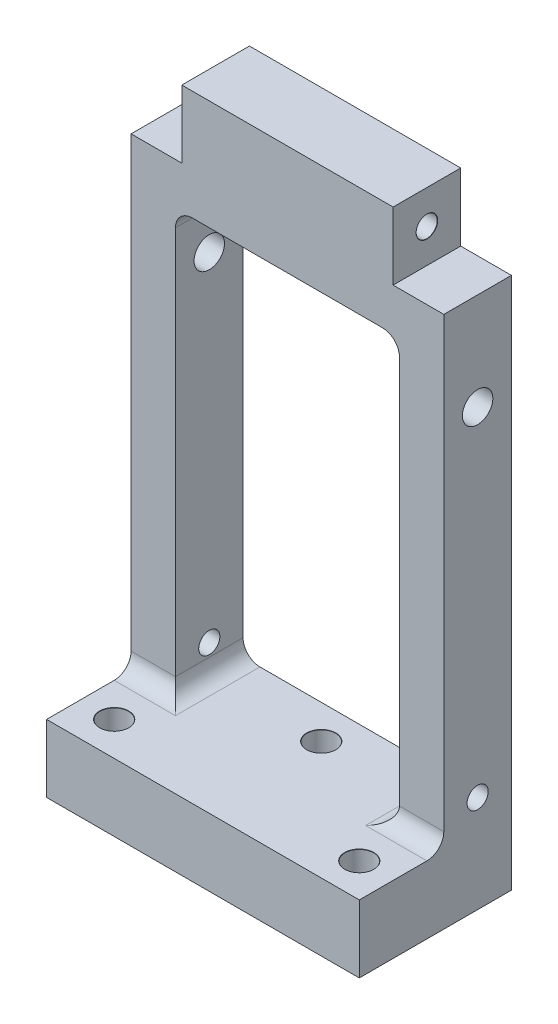
from build123d import *

# Parameters (mm, degrees)
SKETCH1_W                             = 37
SKETCH1_H                             = 63
BOSS_EXTRUDE1_DEPTH                   = 8
SKETCH2_R                             = 1
CUT_EXTRUDE1_DEPTH                    = 10
SKETCH3_W                             = 10
SKETCH3_H                             = 8
BOSS_EXTRUDE2_DEPTH                   = 37
CUT_EXTRUDE2_REACH                    = 68.417
SKETCH4_W                             = 26.5
SKETCH4_H                             = 50
M3_CLEARANCE_HOLE1_AT_2_COUNT         = 2
M3_CLEARANCE_HOLE1_AT_2_PITCH         = 29
M3_CLEARANCE_HOLE1_AT_3_COUNT         = 2
M3_CLEARANCE_HOLE1_AT_3_PITCH         = 17.613914954
FILLET1_R                             = 2
SKETCH8_W                             = 25
SKETCH8_H                             = 8
BOSS_EXTRUDE3_DEPTH                   = 8
SKETCH9_R                             = 1
CUT_EXTRUDE3_DEPTH                    = 5
TAP_DRILL_FOR_M3X0_5_TAP1_D           = 2.5
TAP_DRILL_FOR_M3X0_5_TAP1_CSINK_D     = 2.55
TAP_DRILL_FOR_M3X0_5_TAP1_CSINK_ANGLE = 90
M3_CLEARANCE_HOLE2_D                  = 3.6
M3_CLEARANCE_HOLE2_CSINK_D            = 3.65
M3_CLEARANCE_HOLE2_CSINK_ANGLE        = 90


with BuildPart() as part:
    # Sketch1 → Boss-Extrude1 (new body)
    with BuildSketch(Plane.XY):
        with Locations((0, 31.5)):
            Rectangle(SKETCH1_W, SKETCH1_H)
    extrude(amount=BOSS_EXTRUDE1_DEPTH)

    # Sketch2 → Cut-Extrude1 (cut)
    with BuildSketch(Plane.ZY.offset(18.5)):
        with Locations((4, 51.5)):
            Circle(SKETCH2_R)
        with Locations((4, 11.5)):
            Circle(SKETCH2_R)
    cut_extrude1 = extrude(amount=-CUT_EXTRUDE1_DEPTH, mode=Mode.SUBTRACT)

    # Mirror1: Cut-Extrude1 across plane
    add(cut_extrude1.mirror(Plane(origin=(0, 0, 0), x_dir=(0, 0, 1), z_dir=(1, 0, 0))), mode=Mode.SUBTRACT)

    # Sketch3 → Boss-Extrude2 (add)
    with BuildSketch(Plane.ZY.offset(18.5)):
        with Locations((13, 4)):
            Rectangle(SKETCH3_W, SKETCH3_H)
    extrude(amount=-BOSS_EXTRUDE2_DEPTH)

    # Sketch4 → Cut-Extrude2 (cut, up to next)
    with BuildSketch(Plane.XY.offset(8), mode=Mode.PRIVATE) as cut_extrude2_sk1:
        with Locations((0, 33)):
            Rectangle(SKETCH4_W, SKETCH4_H)
    cut_extrude2_tool1 = extrude(cut_extrude2_sk1.sketch, amount=-CUT_EXTRUDE2_REACH, mode=Mode.PRIVATE) & part.part
    add(cut_extrude2_tool1.solids().sort_by_distance((0, 33, 8))[0], mode=Mode.SUBTRACT)

    # Sketch7 → M3 Clearance Hole1 (revolve, cut)
    with BuildSketch(Plane(origin=(-14.5, 8, 14), x_dir=(0, 0, 1), z_dir=(1, 0, 0))):
        Polygon((0, 0), (0, 8), (1.725, 8), (1.7, 7.975), (1.7, 0.025), (1.725, 0), align=None)
    m3_clearance_hole1 = revolve(axis=Axis((-14.5, 14.35, 14), (0, -1, 0)), mode=Mode.SUBTRACT)

    # M3 Clearance Hole1 at 2: M3 Clearance Hole1 ×2
    with Locations(*[(i * M3_CLEARANCE_HOLE1_AT_2_PITCH, 0, 0) for i in range(1, M3_CLEARANCE_HOLE1_AT_2_COUNT)]):
        add(m3_clearance_hole1, mode=Mode.SUBTRACT)

    # M3 Clearance Hole1 at 3: M3 Clearance Hole1 ×2
    with Locations(*[Vector(0.8232127859153063, 0, -0.5677329558036597) * (i * M3_CLEARANCE_HOLE1_AT_3_PITCH) for i in range(1, M3_CLEARANCE_HOLE1_AT_3_COUNT)]):
        add(m3_clearance_hole1, mode=Mode.SUBTRACT)

    # Fillet1
    fillet1_edges = [part.edges().sort_by_distance(p)[0] for p in [
        (15.875, 8, 8),
        (-15.875, 8, 8),
        (-13.25, 8, 4),
        (-13.25, 58, 4),
        (13.25, 58, 4),
        (13.25, 8, 4),
    ]]
    fillet(fillet1_edges, radius=FILLET1_R)

    # Sketch8 → Boss-Extrude3 (add)
    with BuildSketch(Plane(origin=(0, 0, 0), x_dir=(-1, 0, 0), z_dir=(0, 0, -1))):
        with Locations((0, 67)):
            Rectangle(SKETCH8_W, SKETCH8_H)
    extrude(amount=-BOSS_EXTRUDE3_DEPTH)

    # Sketch9 → Cut-Extrude3 (cut)
    with BuildSketch(Plane.ZY.offset(12.5)):
        with Locations(Location((4, 67, 0), (0, 0, 270))):
            Circle(SKETCH9_R)
    cut_extrude3 = extrude(amount=-CUT_EXTRUDE3_DEPTH, mode=Mode.SUBTRACT)

    # Mirror2: Cut-Extrude3 across plane
    add(cut_extrude3.mirror(Plane(origin=(0, 0, 0), x_dir=(0, 0, 1), z_dir=(1, 0, 0))), mode=Mode.SUBTRACT)

    # Tap Drill for M3x0.5 Tap1 (through all)
    with Locations(Plane.ZY.offset(18.5)):
        with Locations((4, 11.5)):
            CounterSinkHole(TAP_DRILL_FOR_M3X0_5_TAP1_D / 2, TAP_DRILL_FOR_M3X0_5_TAP1_CSINK_D / 2, counter_sink_angle=TAP_DRILL_FOR_M3X0_5_TAP1_CSINK_ANGLE)

    # M3 Clearance Hole2 (through all)
    with Locations(Plane.ZY.offset(18.5)):
        with Locations((4, 51.5)):
            CounterSinkHole(M3_CLEARANCE_HOLE2_D / 2, M3_CLEARANCE_HOLE2_CSINK_D / 2, counter_sink_angle=M3_CLEARANCE_HOLE2_CSINK_ANGLE)

    # Sketch15 → Tap Drill for M3x0.5 Tap2 (revolve, cut)
    with BuildSketch(Plane(origin=(-12.5, 67, 4), x_dir=(0, 0, 1), z_dir=(0, 1, 0))):
        Polygon((0, 0), (0, 20.751075774), (1.25, 20), (1.25, 0.025), (1.275, 0), align=None)
    tap_drill_for_m3x0_5_tap2 = revolve(axis=Axis((-18.85, 67, 4), (1, 0, 0)), mode=Mode.SUBTRACT)

    # Mirror3: Tap Drill for M3x0.5 Tap2 across plane
    add(tap_drill_for_m3x0_5_tap2.mirror(Plane(origin=(0, 0, 0), x_dir=(0, 0, 1), z_dir=(1, 0, 0))), mode=Mode.SUBTRACT)


solid = part.part
